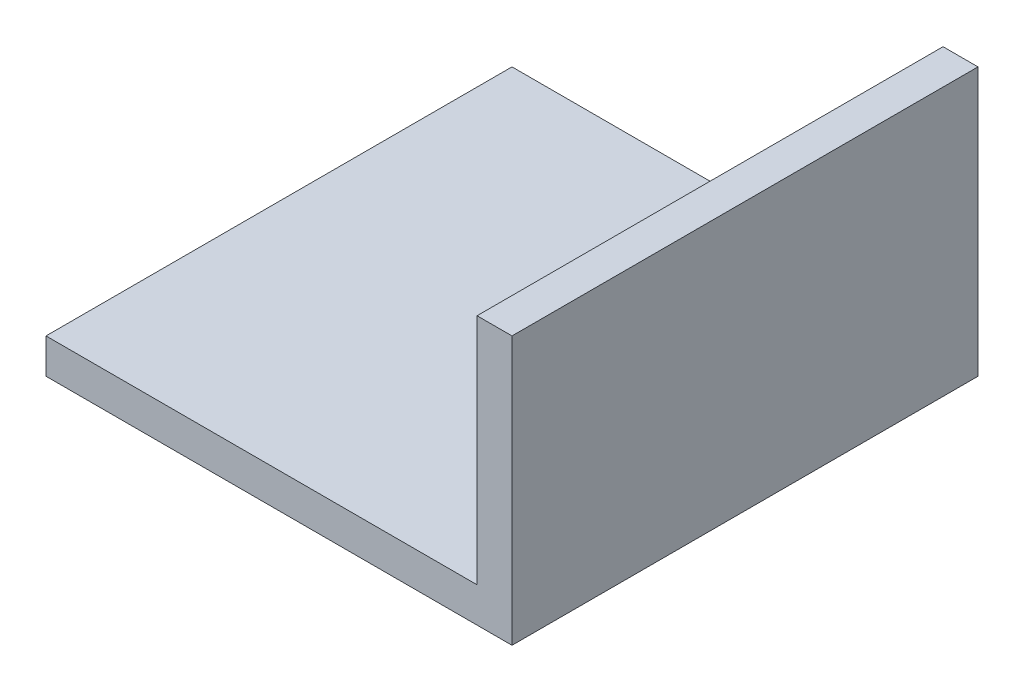
from build123d import *

# Parameters (mm, degrees)
SKETCH1_W      = 40
SKETCH1_H      = 40
EXTRUDE1_DEPTH = 3
SKETCH2_W      = 3
SKETCH2_H      = 40
EXTRUDE2_DEPTH = 20


with BuildPart() as part:
    # Sketch1 → Extrude1 (new body)
    with BuildSketch(Plane(origin=(0, 0, 0), x_dir=(1, 0, 0), z_dir=(0, 1, 0))):
        with Locations((20, 20)):
            Rectangle(SKETCH1_W, SKETCH1_H)
    extrude(amount=EXTRUDE1_DEPTH)

    # Sketch2 → Extrude2 (add)
    with BuildSketch(Plane(origin=(0, 3, 0), x_dir=(1, 0, 0), z_dir=(0, 1, 0))):
        with Locations((38.5, 20)):
            Rectangle(SKETCH2_W, SKETCH2_H)
    extrude(amount=EXTRUDE2_DEPTH)


solid = part.part
